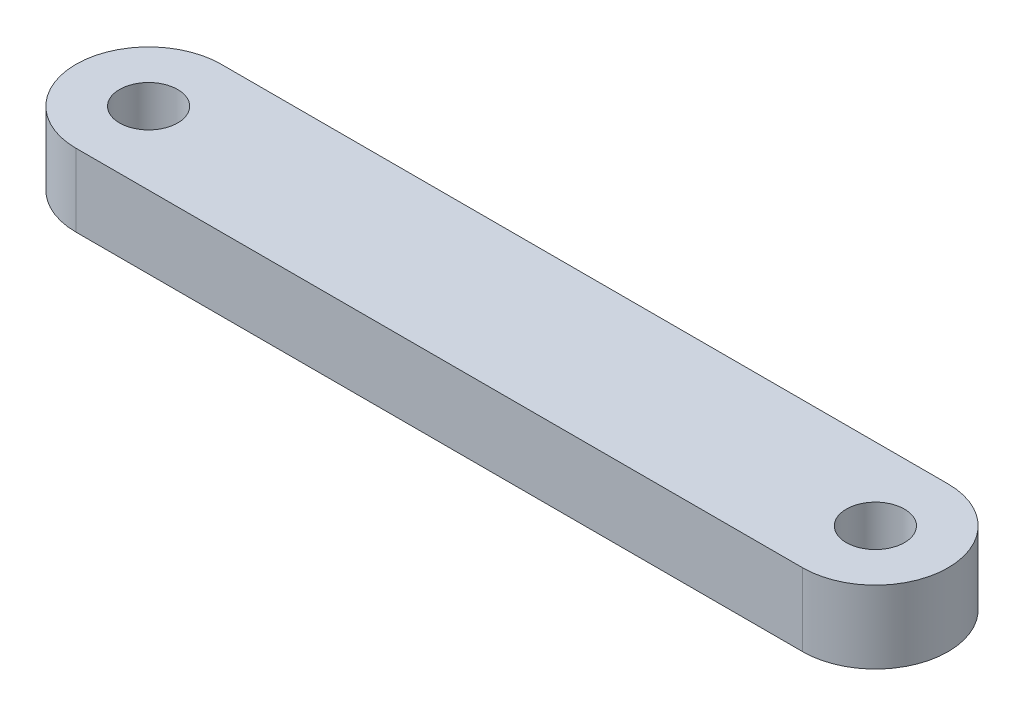
from build123d import *

# Parameters (mm, degrees)
EXTRUDE_1_DEPTH     = 5
SKETCH_2_R          = 2
CUT_EXTRUDE_1_DEPTH = 5


with BuildPart() as part:
    # 草图1 → 凸台-拉伸1 (new body)
    with BuildSketch(Plane(origin=(0, 0, 0), x_dir=(1, 0, 0), z_dir=(0, 1, 0))):
        with BuildLine():
            Line((0, 0), (50, 0))
            ThreePointArc((50, 0), (55, 5), (50, 10))
            Line((50, 10), (0, 10))
            ThreePointArc((0, 10), (-5, 5), (0, 0))
        make_face()
    extrude(amount=EXTRUDE_1_DEPTH)

    # 草图2 → 切除-拉伸1 (cut)
    with BuildSketch(Plane(origin=(0, 5, 0), x_dir=(1, 0, 0), z_dir=(0, 1, 0))):
        with Locations(Location((0, 5, 0), (0, 0, 270))):
            Circle(SKETCH_2_R)
        with Locations(Location((50, 5, 0), (0, 0, 270))):
            Circle(SKETCH_2_R)
    extrude(amount=-CUT_EXTRUDE_1_DEPTH, mode=Mode.SUBTRACT)


solid = part.part
